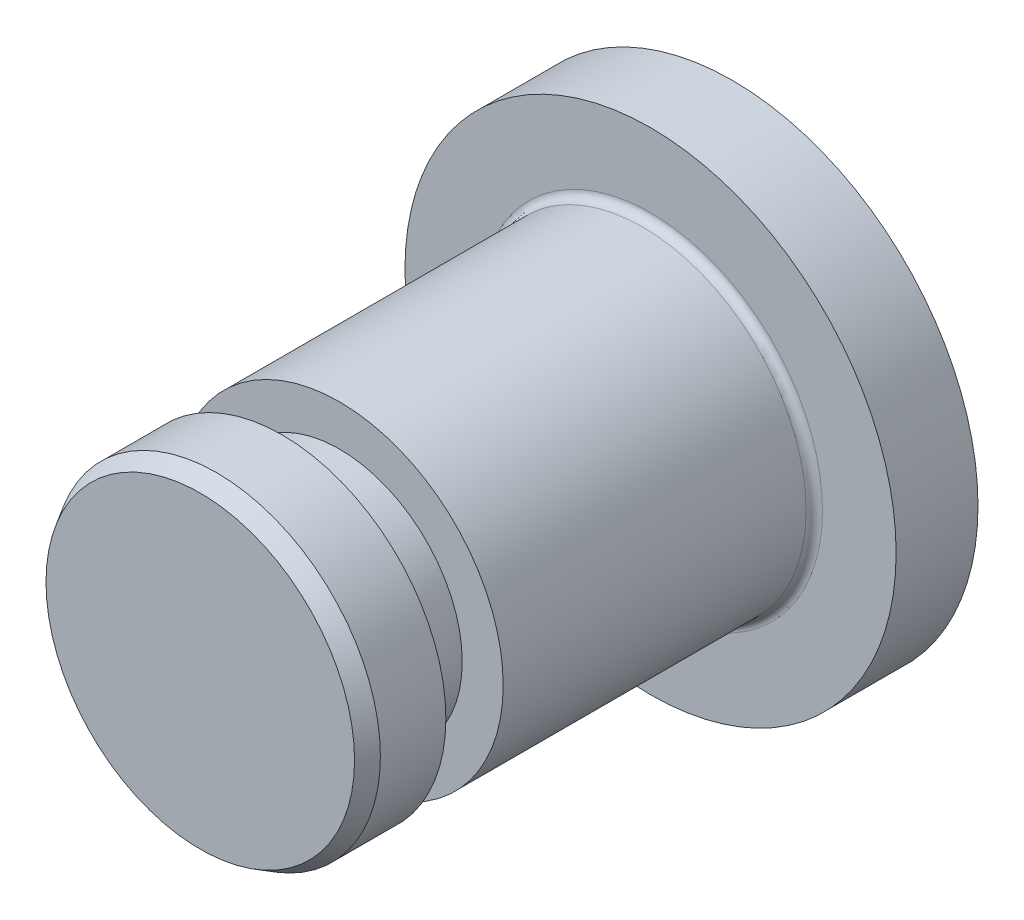
from build123d import *

# Parameters (mm, degrees)
SKETCH_1_R      = 30
EXTRUDE_1_DEPTH = 10
SKETCH_2_R      = 20
EXTRUDE_2_DEPTH = 38
SKETCH_3_R      = 15
EXTRUDE_3_DEPTH = 7
SKETCH_4_R      = 20
EXTRUDE_4_DEPTH = 10
CHAMFER_1_SIZE  = 2
CHAMFER_1_SIZE2 = 1.154700538
FILLET_1_R      = 1


with BuildPart() as part:
    # 草图1 → 凸台-拉伸1 (new body)
    with BuildSketch(Plane.XY):
        Circle(SKETCH_1_R)
    extrude(amount=EXTRUDE_1_DEPTH)

    # 草图2 → 凸台-拉伸2 (add)
    with BuildSketch(Plane.XY.offset(10)):
        Circle(SKETCH_2_R)
    extrude(amount=EXTRUDE_2_DEPTH)

    # 草图3 → 凸台-拉伸3 (add)
    with BuildSketch(Plane.XY.offset(48)):
        Circle(SKETCH_3_R)
    extrude(amount=EXTRUDE_3_DEPTH)

    # 草图4 → 凸台-拉伸4 (add)
    with BuildSketch(Plane.XY.offset(55)):
        Circle(SKETCH_4_R)
    extrude(amount=EXTRUDE_4_DEPTH)

    # 倒角1
    chamfer_1_edges = [part.edges().sort_by_distance(p)[0] for p in [
        (-20, 0, 65),
    ]]
    chamfer_1_side = [part.faces().sort_by_distance(p)[0] for p in [
        (-20, 0, 60),
    ]]
    chamfer(chamfer_1_edges, length=CHAMFER_1_SIZE, length2=CHAMFER_1_SIZE2, reference=chamfer_1_side[0])

    # 圆角1
    fillet_1_edges = [part.edges().sort_by_distance(p)[0] for p in [
        (-20, 0, 10),
    ]]
    fillet(fillet_1_edges, radius=FILLET_1_R)


solid = part.part
